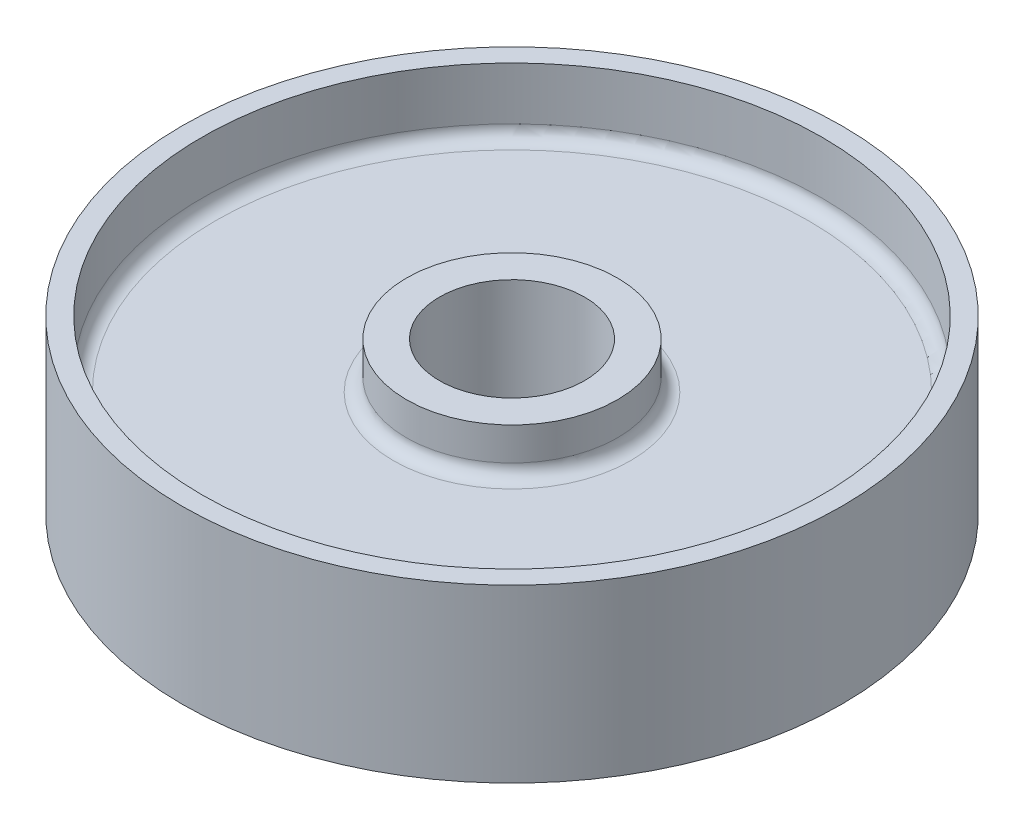
from build123d import *


with BuildPart() as part:
    # Sketch1 → Revolve1 (revolve)
    with BuildSketch(Plane(origin=(0, 0, 0), x_dir=(0, 0, -1), z_dir=(1, 0, 0))):
        with BuildLine():
            Line((11, -10), (11, 10))
            Line((11, 10), (16, 10))
            Line((16, 10), (16, 5))
            ThreePointArc((16, 5), (16.585786438, 3.585786438), (18, 3))
            Line((18, 3), (45, 3))
            ThreePointArc((45, 3), (46.414213562, 3.585786438), (47, 5))
            Line((47, 5), (47, 13))
            Line((47, 13), (50, 13))
            Line((50, 13), (50, -13))
            Line((50, -13), (47, -13))
            Line((47, -13), (47, -5))
            ThreePointArc((47, -5), (46.414213562, -3.585786438), (45, -3))
            Line((45, -3), (18, -3))
            ThreePointArc((18, -3), (16.585786438, -3.585786438), (16, -5))
            Line((16, -5), (16, -10))
            Line((16, -10), (11, -10))
        make_face()
    revolve(axis=Axis((0, 0, 0), (0, 1, 0)))


solid = part.part
